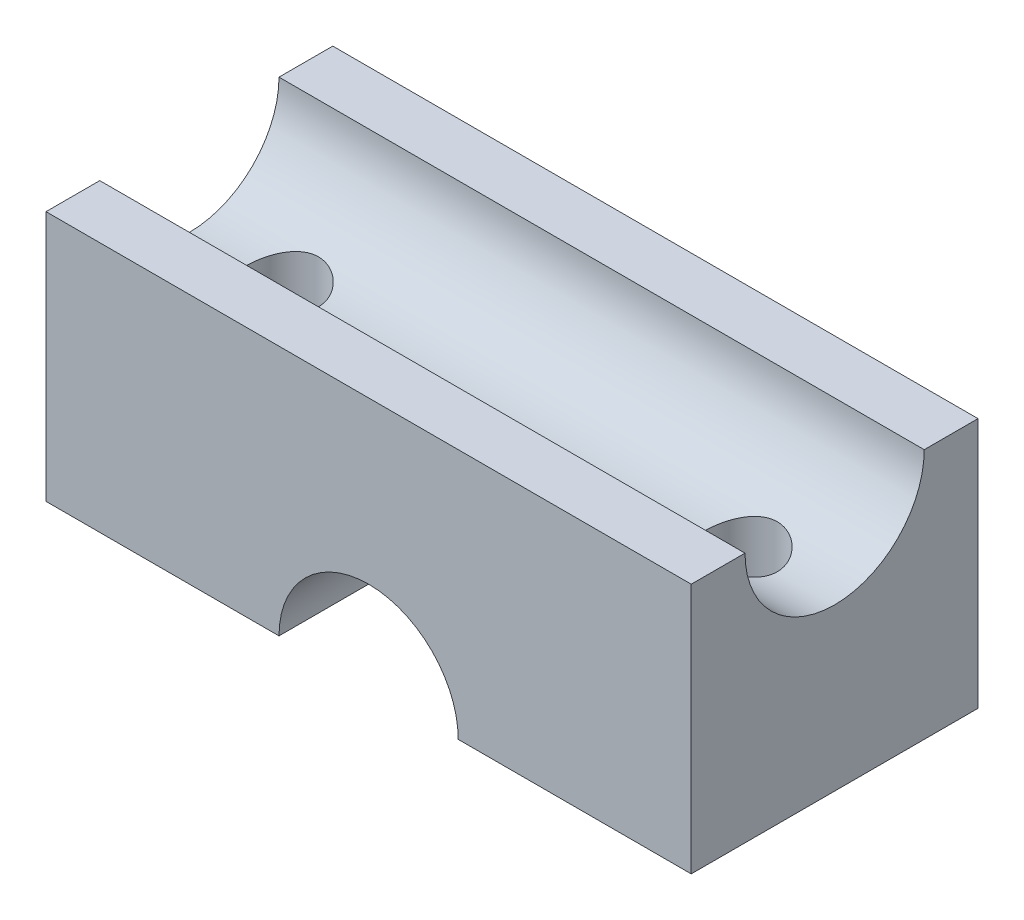
from build123d import *

# Parameters (mm, degrees)
BOSS_EXTRUDE1_DEPTH     = 45
CUT_EXTRUDE1_REACH      = 71.642
SKETCH2_R               = 12.5
CUT_EXTRUDE2_REACH      = 62.415
CUT_EXTRUDE2_END_RADIUS = 12.5
SKETCH3_R               = 5


with BuildPart() as part:
    # Sketch1 → Boss-Extrude1 (new, symmetric)
    with BuildSketch(Plane(origin=(0, 0, 0), x_dir=(0, 0, -1), z_dir=(1, 0, 0))):
        with BuildLine():
            Line((-20, 0), (20, 0))
            Line((20, 0), (20, 35))
            Line((20, 35), (12.5, 35))
            ThreePointArc((12.5, 35), (0, 22.5), (-12.5, 35))
            Line((-12.5, 35), (-20, 35))
            Line((-20, 35), (-20, 0))
        make_face()
    extrude(amount=BOSS_EXTRUDE1_DEPTH, both=True)

    # Sketch2 → Cut-Extrude1 (cut, up to next)
    with BuildSketch(Plane.XY.offset(20), mode=Mode.PRIVATE) as cut_extrude1_sk1:
        Circle(SKETCH2_R)
    cut_extrude1_tool1 = extrude(cut_extrude1_sk1.sketch, amount=-CUT_EXTRUDE1_REACH, mode=Mode.PRIVATE) & part.part
    add(cut_extrude1_tool1.solids().sort_by_distance((0, 0, 20))[0], mode=Mode.SUBTRACT)

    # Cut-Extrude2: up to this cylinder (the profile starts outside it)
    cut_extrude2_end = Plane(origin=(0, 35, 0), z_dir=(-1, 0, 0)) * Cylinder(CUT_EXTRUDE2_END_RADIUS, 214.83, mode=Mode.PRIVATE)
    # Sketch3 → Cut-Extrude2 (cut, up to the surface)
    with BuildSketch(Plane.XZ, mode=Mode.PRIVATE) as cut_extrude2_sk1:
        with Locations(Location((32, 0, 0), (0, 0, 270))):
            Circle(SKETCH3_R)
    cut_extrude2_tool1 = extrude(cut_extrude2_sk1.sketch, amount=-CUT_EXTRUDE2_REACH, mode=Mode.PRIVATE) - cut_extrude2_end
    add(cut_extrude2_tool1.solids().sort_by_distance((32, 0, 0))[0], mode=Mode.SUBTRACT)
    # Sketch3 → Cut-Extrude2 (cut, up to the surface)
    with BuildSketch(Plane.XZ, mode=Mode.PRIVATE) as cut_extrude2_sk2:
        with Locations(Location((-32, 0, 0), (0, 0, 270))):
            Circle(SKETCH3_R)
    cut_extrude2_tool2 = extrude(cut_extrude2_sk2.sketch, amount=-CUT_EXTRUDE2_REACH, mode=Mode.PRIVATE) - cut_extrude2_end
    add(cut_extrude2_tool2.solids().sort_by_distance((-32, 0, 0))[0], mode=Mode.SUBTRACT)


solid = part.part
